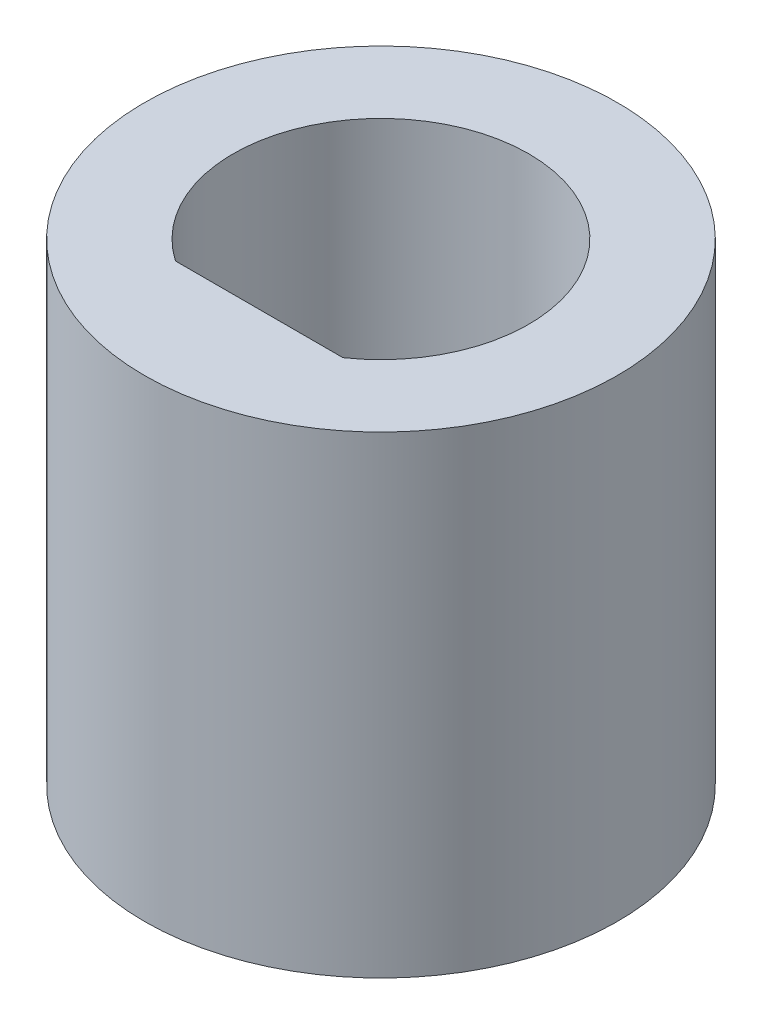
from build123d import *

# Parameters (mm, degrees)
SKETCH1_R           = 5
BOSS_EXTRUDE1_DEPTH = 10


with BuildPart() as part:
    # Sketch1 → Boss-Extrude1 (new body)
    with BuildSketch(Plane(origin=(0, 0, 0), x_dir=(1, 0, 0), z_dir=(0, 1, 0))):
        with Locations(Location((0, 0, 0), (0, 0, 270))):
            Circle(SKETCH1_R)
        with BuildLine():
            Line((-1.770593121, -2.575), (1.770593121, -2.575))
            ThreePointArc((1.770593121, -2.575), (0, 3.125), (-1.770593121, -2.575))
        make_face(mode=Mode.SUBTRACT)
    extrude(amount=BOSS_EXTRUDE1_DEPTH)


solid = part.part
